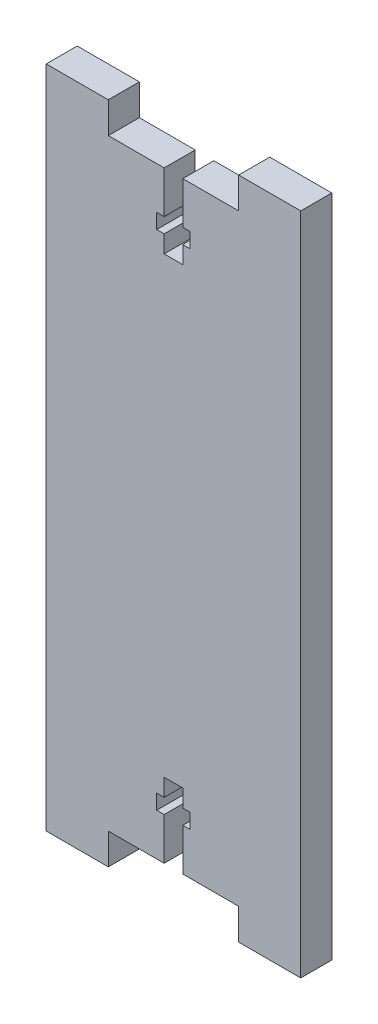
from build123d import *

# Parameters (mm, degrees)
RESSALTO_EXTRUS_O1_DEPTH = 5


with BuildPart() as part:
    # Model → Ressalto-extrusão1 (new body)
    with BuildSketch(Plane.XY):
        Polygon((52.002073691, 87.500000998), (61.000000611, 87.500000998), (61.000000611, 92.500000998), (71.000000611, 92.500000998), (71.000000611, -14.5), (61.000000611, -14.5), (61.000000611, -9.5), (52.002073691, -9.5), (52.002073691, -2.7), (53.202073691, -2.7), (53.202073691, -0.3), (52.002073691, -0.3), (52.002073691, 2.5), (49.002073691, 2.5), (49.002073691, -0.3), (47.802073691, -0.3), (47.802073691, -2.7), (49.002073691, -2.7), (49.002073691, -9.5), (40.004146771, -9.5), (40.004146771, -14.5), (30.004146771, -14.5), (30.004146771, 92.500000998), (40.004146771, 92.500000998), (40.004146771, 87.500000998), (49.002073691, 87.500000998), (49.002073691, 80.700000998), (47.802073691, 80.700000998), (47.802073691, 78.300000998), (49.002073691, 78.300000998), (49.002073691, 75.500000998), (52.002073691, 75.500000998), (52.002073691, 78.300000998), (53.202073691, 78.300000998), (53.202073691, 80.700000998), (52.002073691, 80.700000998), align=None)
    extrude(amount=RESSALTO_EXTRUS_O1_DEPTH)


solid = part.part
